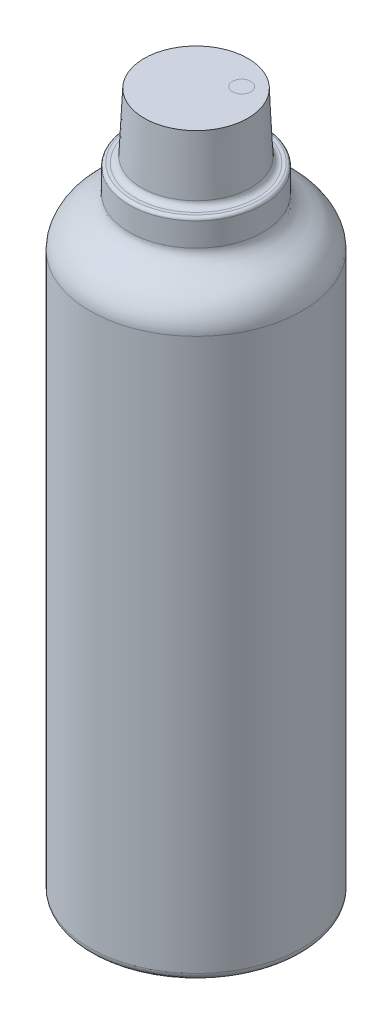
from build123d import *


with BuildPart() as part:
    # Sketch1 → Revolve1 (revolve)
    with BuildSketch(Plane.XY, mode=Mode.PRIVATE) as revolve1_sk:
        with BuildLine():
            Line((28.176458362, 0), (32.4, 0))
            ThreePointArc((32.4, 0), (34.167766953, 0.732233047), (34.9, 2.5))
            Line((34.9, 2.5), (34.9, 184))
            add(Edge.make_bspline(
                [(34.9, 184), (34.9, 186.989827139), (31.915630123, 192.216128506), (25.82490647, 195.027230742), (22, 197.912231806), (22, 200)],
                knots=[0, 0, 0, 0, 0.423782802, 0.726128109, 1, 1, 1, 1], degree=3))
            Line((22, 200), (22, 207.75))
            ThreePointArc((22, 207.75), (21.707106781, 208.457106781), (21, 208.75))
            Line((21, 208.75), (19.968095661, 208.75))
            ThreePointArc((19.968095661, 208.75), (18.587521001, 209.302929301), (17.970306523, 210.655986393))
            Line((17.970306523, 210.655986393), (17.06, 230))
            Line((17.06, 230), (0, 230))
            Line((0, 230), (0, 1))
            Line((0, 1), (24.371019058, 1))
            ThreePointArc((24.371019058, 1), (24.891963591, 0.954423259), (25.397079488, 0.819077862))
            Line((25.397079488, 0.819077862), (27.150397932, 0.180922138))
            ThreePointArc((27.150397932, 0.180922138), (27.655513829, 0.045576741), (28.176458362, 0))
        make_face()
    revolve(revolve1_sk.sketch.rotate(Axis((0, 0, 0), (0, 1, 0)), 90), axis=Axis((0, 0, 0), (0, 1, 0)))


solid = part.part
